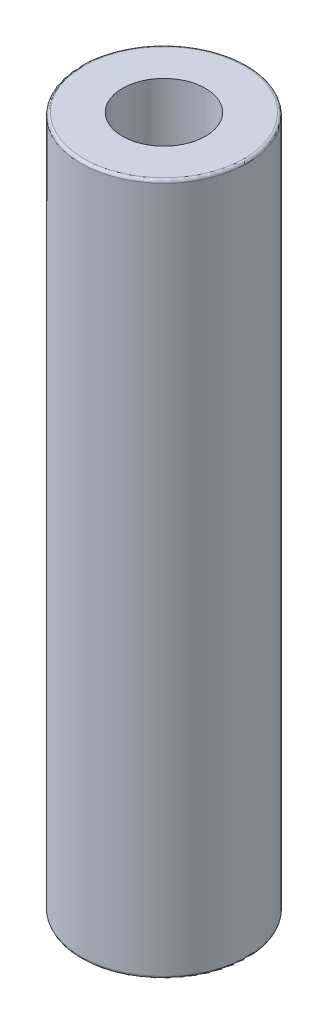
from build123d import *

# Parameters (mm, degrees)
SKETCH_1_R      = 3
SKETCH_1_R_2    = 1.5
EXTRUDE_1_DEPTH = 25
FILLET_1_R      = 0.1


with BuildPart() as part:
    # ｽｹｯﾁ1 → ﾎﾞｽ - 押し出し1 (new body)
    with BuildSketch(Plane(origin=(0, 0, 0), x_dir=(1, 0, 0), z_dir=(0, 1, 0))):
        with Locations(Location((0, 0, 0), (0, 0, 270))):
            Circle(SKETCH_1_R)
        with Locations(Location((0, 0, 0), (0, 0, 270))):
            Circle(SKETCH_1_R_2, mode=Mode.SUBTRACT)
    extrude(amount=EXTRUDE_1_DEPTH)

    # ﾌｨﾚｯﾄ1
    fillet_1_edges = [part.edges().sort_by_distance(p)[0] for p in [
        (0, 0, -3),
        (0, 25, -3),
    ]]
    fillet(fillet_1_edges, radius=FILLET_1_R)


solid = part.part
